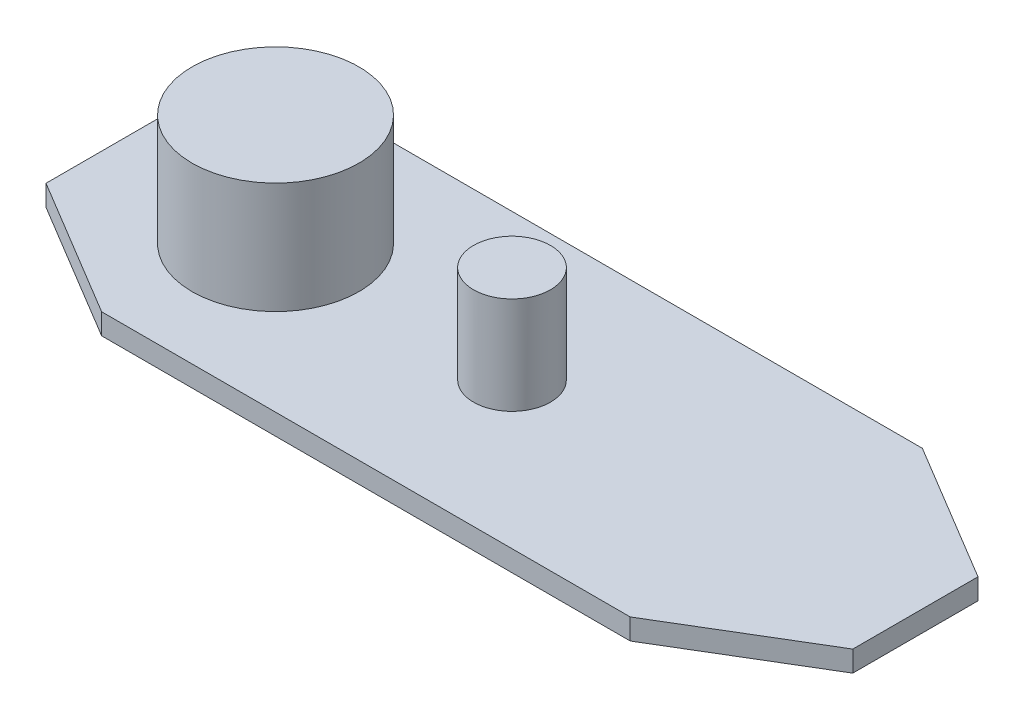
from build123d import *

# Parameters (mm, degrees)
BOSS_EXTRUDE1_DEPTH = 1.5
SKETCH2_R           = 6
BOSS_EXTRUDE2_DEPTH = 8
SKETCH3_R           = 2.764055342
BOSS_EXTRUDE3_DEPTH = 7


with BuildPart() as part:
    # Sketch1 → Boss-Extrude1 (new body)
    with BuildSketch(Plane(origin=(0, 0, 0), x_dir=(1, 0, 0), z_dir=(0, 1, 0))):
        Polygon((-19, 10.5), (19, 10.5), (29, 4.5), (29, -4.5), (19, -10.5), (-19, -10.5), (-29, -4.5), (-29, 4.5), align=None)
    extrude(amount=BOSS_EXTRUDE1_DEPTH)

    # Sketch2 → Boss-Extrude2 (add)
    with BuildSketch(Plane(origin=(0, 1.5, 0), x_dir=(1, 0, 0), z_dir=(0, 1, 0))):
        with Locations(Location((-17, 0, 0), (0, 0, 270))):
            Circle(SKETCH2_R)
    extrude(amount=BOSS_EXTRUDE2_DEPTH)

    # Sketch3 → Boss-Extrude3 (add)
    with BuildSketch(Plane(origin=(0, 1.5, 0), x_dir=(1, 0, 0), z_dir=(0, 1, 0))):
        with Locations(Location((0, 0, 0), (0, 0, 90))):
            Circle(SKETCH3_R)
    extrude(amount=BOSS_EXTRUDE3_DEPTH)


solid = part.part
